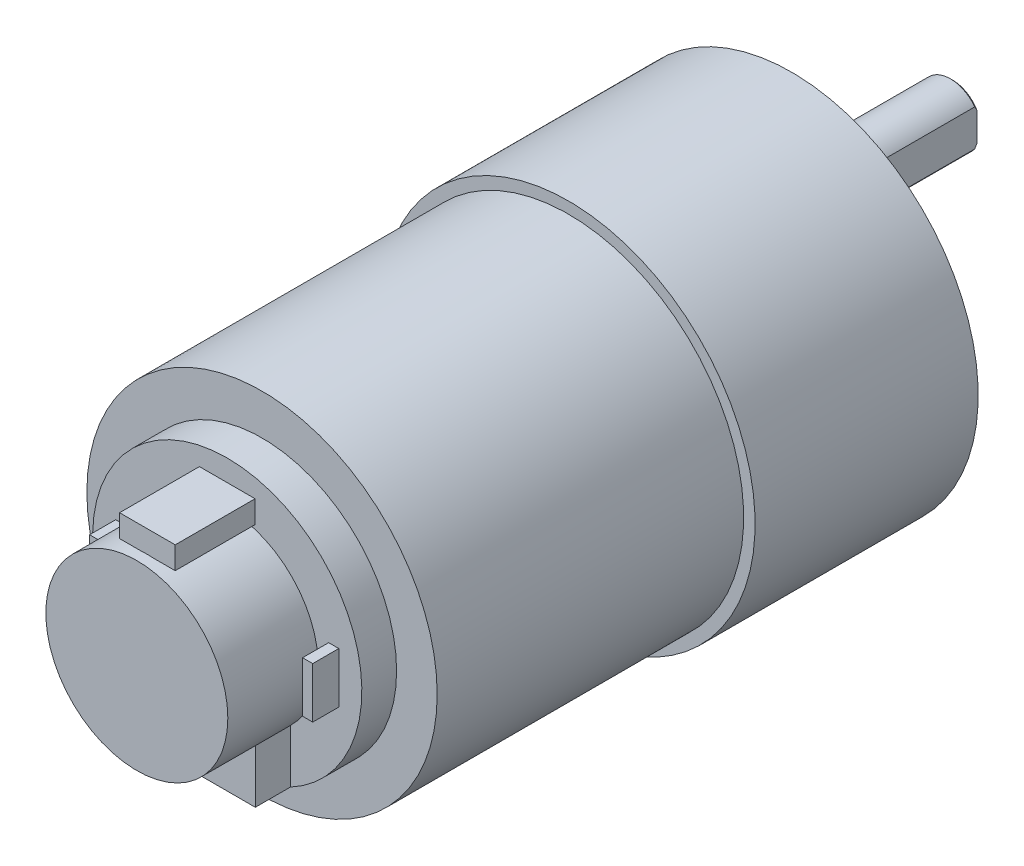
from build123d import *

# Parameters (mm, degrees)
SKETCH1_R                   = 17.272
BOSS_EXTRUDE1_DEPTH         = 52.22
SKETCH1_3_R                 = 6
BOSS_EXTRUDE2_DEPTH         = 6.5
BOSS_EXTRUDE3_DEPTH         = 22.86
BOSS_EXTRUDE4_DEPTH         = 10.668
SKETCH2_W                   = 1
SKETCH2_H                   = 5
BOSS_EXTRUDE5_DEPTH         = 6
SKETCH4_R                   = 18.4
BOSS_EXTRUDE6_DEPTH         = 22
TAP_DRILL_FOR_M3_TAP1_D     = 2.5
TAP_DRILL_FOR_M3_TAP1_DEPTH = 3
TAP_DRILL_FOR_M3_TAP1_TIP   = 0.751075774
SKETCH9_R                   = 13.2715
BOSS_EXTRUDE7_DEPTH         = 3.429
SKETCH10_R                  = 8.97255
BOSS_EXTRUDE8_DEPTH         = 8.9154
SKETCH11_W                  = 12.446
SKETCH11_H                  = 6.0452
BOSS_EXTRUDE9_DEPTH         = 3.4544
SKETCH12_W                  = 5.4864
SKETCH12_H                  = 2.2098
BOSS_EXTRUDE10_DEPTH        = 7.874
CHAMFER1_SIZE               = 0.2
CHAMFER2_SIZE               = 0.5


with BuildPart() as part:
    # Sketch1 → Boss-Extrude1 (new body)
    with BuildSketch(Plane.XY):
        Circle(SKETCH1_R)
    extrude(amount=BOSS_EXTRUDE1_DEPTH)

    # Sketch1<3> → Boss-Extrude2 (add)
    with BuildSketch(Plane.XY):
        with Locations((-7, 0)):
            Circle(SKETCH1_3_R)
    extrude(amount=-BOSS_EXTRUDE2_DEPTH)

    # Sketch1<4> → Boss-Extrude3 (add)
    with BuildSketch(Plane.XY):
        with BuildLine():
            Line((-4.6, -1.8), (-4.6, 1.8))
            ThreePointArc((-4.6, 1.8), (-10, 0), (-4.6, -1.8))
        make_face()
    extrude(amount=-BOSS_EXTRUDE3_DEPTH)

    # Sketch1<5> → Boss-Extrude4 (add)
    with BuildSketch(Plane.XY):
        with BuildLine():
            ThreePointArc((-4.6, -1.8), (-4, 0), (-4.6, 1.8))
            Line((-4.6, 1.8), (-4.6, -1.8))
        make_face()
    extrude(amount=-BOSS_EXTRUDE4_DEPTH)

    # Sketch2 → Boss-Extrude5 (add)
    with BuildSketch(Plane.XY.offset(52.22)):
        with Locations((-10.5, 0)):
            Rectangle(SKETCH2_W, SKETCH2_H)
        with Locations((10.5, 0)):
            Rectangle(SKETCH2_W, SKETCH2_H)
    extrude(amount=BOSS_EXTRUDE5_DEPTH)

    # Sketch4 → Boss-Extrude6 (add)
    with BuildSketch(Plane(origin=(0, 0, 0), x_dir=(-1, 0, 0), z_dir=(0, 0, -1))):
        Circle(SKETCH4_R)
    extrude(amount=-BOSS_EXTRUDE6_DEPTH)

    # Tap Drill for M3 Tap1
    with Locations(Plane(origin=(0, 0, 0), x_dir=(-1, 0, 0), z_dir=(0, 0, -1))):
        with Locations((-13.423393759, -7.75), (0, -15.5), (0, 15.5), (13.423393759, 7.75), (13.423393759, -7.75), (-13.423393759, 7.75)):
            Hole(TAP_DRILL_FOR_M3_TAP1_D / 2, depth=TAP_DRILL_FOR_M3_TAP1_DEPTH)
            with Locations((0, 0, -(TAP_DRILL_FOR_M3_TAP1_DEPTH + TAP_DRILL_FOR_M3_TAP1_TIP / 2))):  # 118° drill point
                Cone(0, TAP_DRILL_FOR_M3_TAP1_D / 2, TAP_DRILL_FOR_M3_TAP1_TIP, mode=Mode.SUBTRACT)

    # Sketch9 → Boss-Extrude7 (add)
    with BuildSketch(Plane.XY.offset(52.22)):
        Circle(SKETCH9_R)
    extrude(amount=BOSS_EXTRUDE7_DEPTH)

    # Sketch10 → Boss-Extrude8 (add)
    with BuildSketch(Plane.XY.offset(55.649)):
        Circle(SKETCH10_R)
    extrude(amount=BOSS_EXTRUDE8_DEPTH)

    # Sketch11 → Boss-Extrude9 (add)
    with BuildSketch(Plane.XY.offset(55.649)):
        with Locations((0, -8.699472481)):
            Rectangle(SKETCH11_W, SKETCH11_H)
    extrude(amount=BOSS_EXTRUDE9_DEPTH)

    # Sketch12 → Boss-Extrude10 (add)
    with BuildSketch(Plane.XY.offset(55.649)):
        with Locations((0, 10.0584)):
            Rectangle(SKETCH12_W, SKETCH12_H)
    extrude(amount=BOSS_EXTRUDE10_DEPTH)

    # Chamfer1
    chamfer1_edges = [part.edges().sort_by_distance(p)[0] for p in [
        (-10, 0, -22.86),
    ]]
    chamfer(chamfer1_edges, length=CHAMFER1_SIZE)

    # Chamfer2
    chamfer2_edges = [part.edges().sort_by_distance(p)[0] for p in [
        (-13, 0, -6.5),
    ]]
    chamfer(chamfer2_edges, length=CHAMFER2_SIZE)


solid = part.part
